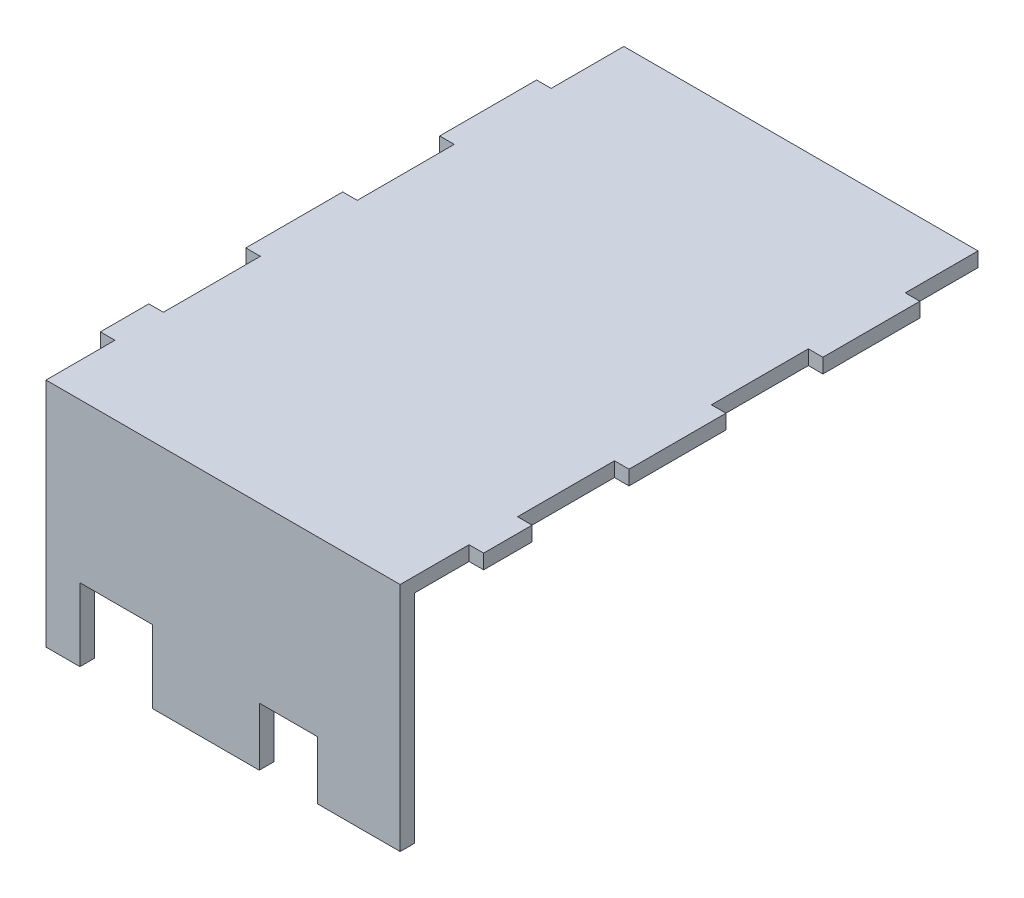
from build123d import *

# Parameters (mm, degrees)
SALIENTE_EXTRUIR1_DEPTH = 3
CROQUIS2_W              = 73.07
CROQUIS2_H              = 3
SALIENTE_EXTRUIR2_DEPTH = 47.72
CROQUIS3_W              = 15
CROQUIS3_H              = 15
CROQUIS3_W_2            = 12
CROQUIS3_H_2            = 12
CORTAR_EXTRUIR1_DEPTH   = 47.72


with BuildPart() as part:
    # Croquis1 → Saliente-Extruir1 (new body)
    with BuildSketch(Plane(origin=(0, 0, 0), x_dir=(1, 0, 0), z_dir=(0, 1, 0))):
        Polygon((29.065596193, -79.884359085), (29.065596193, -82.884359085), (29.065596193, -94.104359085), (-44.004403807, -94.104359085), (-44.004403807, -79.884359085), (-47.004403807, -79.884359085), (-47.004403807, -69.884359085), (-44.004403807, -69.884359085), (-44.004403807, -49.884359085), (-47.004403807, -49.884359085), (-47.004403807, -29.884359085), (-44.004403807, -29.884359085), (-44.004403807, -9.884359085), (-47.004403807, -9.884359085), (-47.004403807, 10.115640915), (-44.004403807, 10.115640915), (-44.004403807, 25.115640915), (29.065596193, 25.115640915), (29.065596193, 10.115640915), (32.065596193, 10.115640915), (32.065596193, -9.884359085), (29.065596193, -9.884359085), (29.065596193, -29.884359085), (32.065596193, -29.884359085), (32.065596193, -49.884359085), (29.065596193, -49.884359085), (29.065596193, -69.884359085), (32.065596193, -69.884359085), (32.065596193, -79.884359085), align=None)
    extrude(amount=SALIENTE_EXTRUIR1_DEPTH)

    # Croquis2 → Saliente-Extruir2 (add)
    with BuildSketch(Plane(origin=(0, 3, 0), x_dir=(1, 0, 0), z_dir=(0, 1, 0))):
        with Locations((-7.469403807, -92.604359085)):
            Rectangle(CROQUIS2_W, CROQUIS2_H)
    extrude(amount=-SALIENTE_EXTRUIR2_DEPTH)

    # Croquis3 → Cortar-Extruir1 (cut)
    with BuildSketch(Plane.XY.offset(94.104359085)):
        with Locations((-29.504403807, -37.22)):
            Rectangle(CROQUIS3_W, CROQUIS3_H)
        with Locations((5.995596193, -38.72)):
            Rectangle(CROQUIS3_W_2, CROQUIS3_H_2)
    extrude(amount=-CORTAR_EXTRUIR1_DEPTH, mode=Mode.SUBTRACT)


solid = part.part
